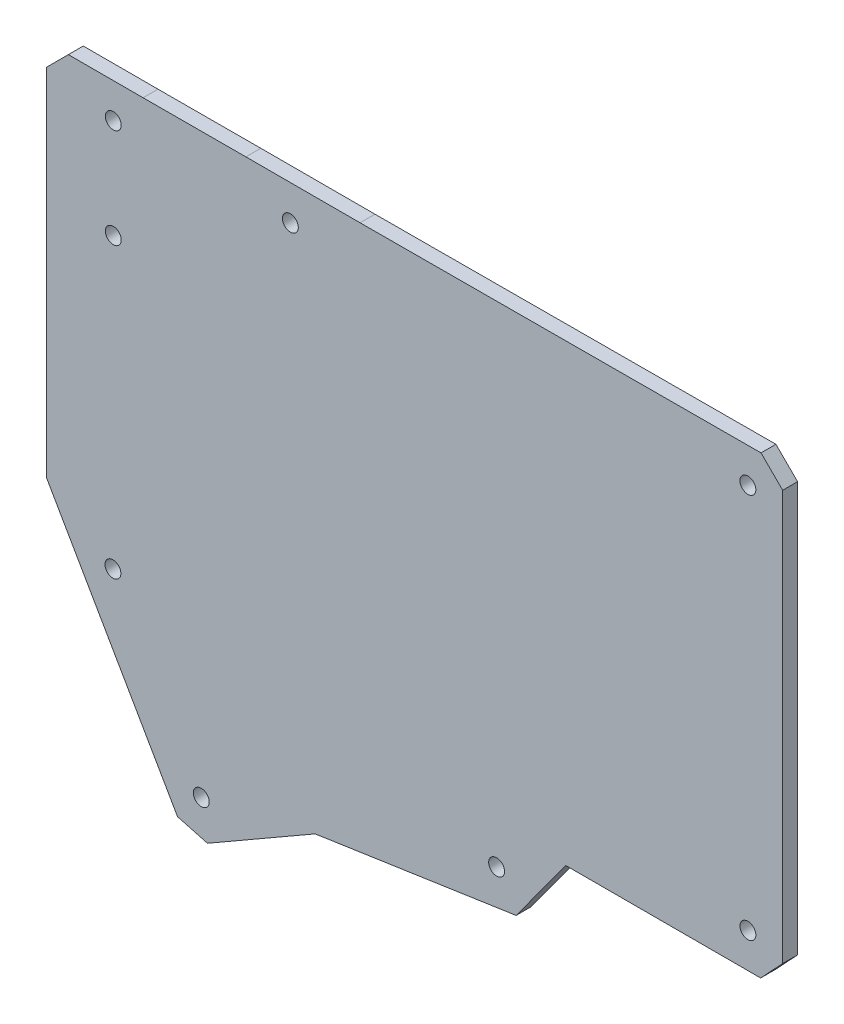
from build123d import *

# Parameters (mm, degrees)
ESQUISSE1_R        = 1.6
BOSS_EXTRU_1_DEPTH = 3


with BuildPart() as part:
    # Esquisse1 → Boss.-Extru.1 (new body)
    with BuildSketch(Plane.XY):
        Polygon((-15.693595538, 5.608560861), (-96.367147031, 5.364168479), (-103.365175584, 5.364168479), (-119.344550333, 5.364168479), (-140.021777649, 5.320852512), (-155.064772313, 5.320852512), (-159.478985875, 0.90663895), (-159.478985875, -3.429484403), (-159.478985875, -70.574320891), (-133.100653393, -116.486520024), (-127.076613358, -118.11178196), (-105.412894174, -105.642711064), (-64.97062335, -99.631001274), (-54.971738012, -85.933633781), (-15.772854297, -85.933633781), (-11.339106961, -81.196072129), (-11.339106961, 1.267243786), align=None)
        with Locations((-18.339106961, -1.341926987)):
            Circle(ESQUISSE1_R, mode=Mode.SUBTRACT)
        with Locations((-110.397084988, -1.678365923)):
            Circle(ESQUISSE1_R, mode=Mode.SUBTRACT)
        with Locations((-18.339106961, -78.933633781)):
            Circle(ESQUISSE1_R, mode=Mode.SUBTRACT)
        with Locations((-68.897334865, -93.137788223)):
            Circle(ESQUISSE1_R, mode=Mode.SUBTRACT)
        with Locations((-128.322250168, -110.752044388)):
            Circle(ESQUISSE1_R, mode=Mode.SUBTRACT)
        with Locations((-146.0923789, -79.822656053)):
            Circle(ESQUISSE1_R, mode=Mode.SUBTRACT)
        with Locations((-146.02282508, -1.677868186)):
            Circle(ESQUISSE1_R, mode=Mode.SUBTRACT)
        with Locations((-146.02282508, -21.677868186)):
            Circle(ESQUISSE1_R, mode=Mode.SUBTRACT)
    extrude(amount=BOSS_EXTRU_1_DEPTH)


solid = part.part
